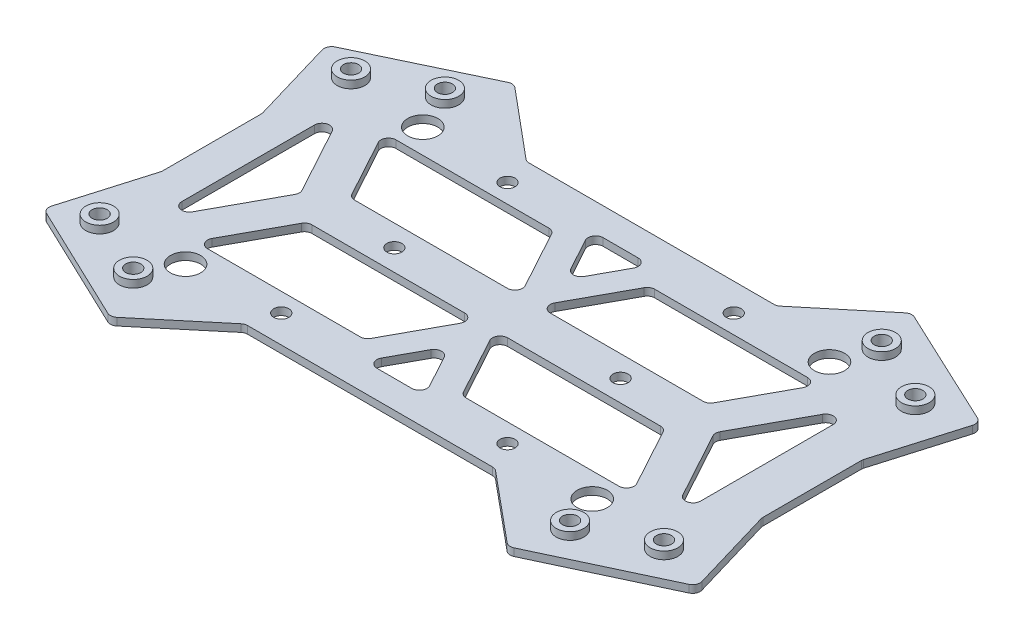
from build123d import *

# Parameters (mm, degrees)
SKETCH1_R               = 1.5
BOSS_EXTRUDE1_DEPTH     = 1.5
CUT_EXTRUDE3_DEPTH      = 78.112196707
CUT_EXTRUDE3_DEPTH_BACK = 1.5
SKETCH2_R               = 3
SKETCH2_R_2             = 1.5
FILLET1_R               = 1.5
FILLET2_R               = 1.5
FILLET3_R               = 1.5
FILLET4_R               = 1.5
SKETCH3_R               = 2.75
SKETCH3_R_2             = 1.5
BOSS_EXTRUDE2_DEPTH     = 1.5


with BuildPart() as part:
    # Sketch1 → Boss-Extrude1 (new body)
    with BuildSketch(Plane(origin=(0, 0, 0), x_dir=(1, 0, 0), z_dir=(0, 1, 0))):
        with BuildLine():
            Line((-39.718703085, 39.786008686), (-64.143839052, 28.145904827))
            Line((-64.143839052, 28.145904827), (-58.793839052, 10))
            Line((-58.793839052, 10), (-58.793839052, 0))
            Line((-58.793839052, 0), (60.6, 0))
            Line((60.6, 0), (60.6, 10))
            Line((60.6, 10), (65.947243643, 28.142062598))
            Line((65.947243643, 28.142062598), (41.112235129, 39.795412747))
            ThreePointArc((41.112235129, 39.795412747), (40.285063102, 39.92539514), (39.517091476, 39.591735783))
            Line((39.517091476, 39.591735783), (25.966587834, 28.345739563))
            ThreePointArc((25.966587834, 28.345739563), (25.517849862, 28.089079971), (25.008630192, 28))
            Line((25.008630192, 28), (-23.705783083, 28))
            ThreePointArc((-23.705783083, 28), (-24.217369993, 28.089936585), (-24.667609729, 28.348961555))
            Line((-24.667609729, 28.348961555), (-38.111565458, 39.582951958))
            ThreePointArc((-38.111565458, 39.582951958), (-38.885366706, 39.920082337), (-39.718703085, 39.786008686))
        make_face()
        with Locations(Location((-43.45, 31, 0), (0, 0, 270))):
            Circle(SKETCH1_R, mode=Mode.SUBTRACT)
        with Locations(Location((-56.13, 25, 0), (0, 0, 270))):
            Circle(SKETCH1_R, mode=Mode.SUBTRACT)
        with Locations(Location((56.13, 25, 0), (0, 0, 270))):
            Circle(SKETCH1_R, mode=Mode.SUBTRACT)
        with Locations(Location((43.45, 31, 0), (0, 0, 270))):
            Circle(SKETCH1_R, mode=Mode.SUBTRACT)
    extrude(amount=BOSS_EXTRUDE1_DEPTH)

    # Sketch2 → Cut-Extrude3 (cut, two sides: drawn at the far end of the back side and taken through both)
    with BuildSketch(Plane(origin=(0, 0, 0), x_dir=(1, 0, 0), z_dir=(0, 1, 0)).offset(-CUT_EXTRUDE3_DEPTH_BACK)):
        with Locations(Location((40.45, 23.6, 0), (0, 0, 270))):
            Circle(SKETCH2_R)
        with Locations(Location((-40.45, 23.6, 0), (0, 0, 270))):
            Circle(SKETCH2_R)
        with Locations(Location((-22.5, 22.5, 0), (0, 0, 270))):
            Circle(SKETCH2_R_2)
        with Locations(Location((22.5, 22.5, 0), (0, 0, 270))):
            Circle(SKETCH2_R_2)
        Polygon((-6, 22.5), (6, 22.5), (0, 11.5), align=None)
        Polygon((1.740892766, 4.25), (9.649983676, 18.75), (43.45, 18.75), (35.540909091, 4.25), align=None)
        Polygon((-43.45, 18.75), (-35.540909091, 4.25), (-1.740892766, 4.25), (-9.649983676, 18.75), align=None)
        Polygon((41.196340782, 0), (51.6, 19.073375233), (51.6, 0), align=None)
        Polygon((-51.6, 0), (-41.196340782, 0), (-51.6, 19.073375233), align=None)
        with BuildLine():
            Line((21, 0), (24, 0))
            ThreePointArc((24, 0), (22.5, 1.5), (21, 0))
        make_face()
        with BuildLine():
            Line((-24, 0), (-21, 0))
            ThreePointArc((-21, 0), (-22.5, 1.5), (-24, 0))
        make_face()
    extrude(amount=CUT_EXTRUDE3_DEPTH + CUT_EXTRUDE3_DEPTH_BACK, mode=Mode.SUBTRACT)

    # Mirror1: part across plane


with BuildPart() as part_1:
    add(part.part)
    add(part.part.mirror(Plane.XY))

    # Fillet1
    fillet1_edges = [part_1.edges().sort_by_distance(p)[0] for p in [
        (1.740892766, 0.75, -4.25),
        (35.540909091, 0.75, -4.25),
        (43.45, 0.75, -18.75),
        (9.649983676, 0.75, -18.75),
        (1.740892766, 0.75, 4.25),
        (35.540909091, 0.75, 4.25),
        (43.45, 0.75, 18.75),
        (9.649983676, 0.75, 18.75),
        (-9.649983676, 0.75, 18.75),
        (-43.45, 0.75, 18.75),
        (-35.540909091, 0.75, 4.25),
        (-1.740892766, 0.75, 4.25),
        (-9.649983676, 0.75, -18.75),
        (-43.45, 0.75, -18.75),
        (-35.540909091, 0.75, -4.25),
        (-1.740892766, 0.75, -4.25),
    ]]
    fillet(fillet1_edges, radius=FILLET1_R)

    # Fillet2
    fillet2_edges = [part_1.edges().sort_by_distance(p)[0] for p in [
        (51.6, 0.75, -19.073375233),
        (-51.6, 0.75, -19.073375233),
        (41.196340782, 0.75, 0),
        (-51.6, 0.75, 19.073375233),
        (-41.196340782, 0.75, 0),
        (51.6, 0.75, 19.073375233),
    ]]
    fillet(fillet2_edges, radius=FILLET2_R)

    # Fillet3
    fillet3_edges = [part_1.edges().sort_by_distance(p)[0] for p in [
        (-6, 0.75, -22.5),
        (0, 0.75, -11.5),
        (6, 0.75, -22.5),
        (-6, 0.75, 22.5),
        (0, 0.75, 11.5),
        (6, 0.75, 22.5),
    ]]
    fillet(fillet3_edges, radius=FILLET3_R)

    # Fillet4
    fillet4_edges = [part_1.edges().sort_by_distance(p)[0] for p in [
        (-58.793839052, 0.75, 10),
        (60.6, 0.75, 10),
        (65.947243643, 0.75, 28.142062598),
        (-64.143839052, 0.75, 28.145904827),
        (-64.143839052, 0.75, -28.145904827),
        (65.947243643, 0.75, -28.142062598),
        (60.6, 0.75, -10),
        (-58.793839052, 0.75, -10),
    ]]
    fillet(fillet4_edges, radius=FILLET4_R)

    # Sketch3 → Boss-Extrude2 (add)
    # profile 1 of 4: a face of its own
    with BuildSketch(Plane(origin=(0, 1.5, 0), x_dir=(1, 0, 0), z_dir=(0, 1, 0))):
        with Locations(Location((-56.13, 25, 0), (0, 0, 270))):
            Circle(SKETCH3_R)
        with Locations(Location((-56.13, 25, 0), (0, 0, 270))):
            Circle(SKETCH3_R_2, mode=Mode.SUBTRACT)
    # profile 2 of 4: a face of its own
    with BuildSketch(Plane(origin=(0, 1.5, 0), x_dir=(1, 0, 0), z_dir=(0, 1, 0))):
        with Locations(Location((-43.45, 31, 0), (0, 0, 270))):
            Circle(SKETCH3_R)
        with Locations(Location((-43.45, 31, 0), (0, 0, 270))):
            Circle(SKETCH3_R_2, mode=Mode.SUBTRACT)
    # profile 3 of 4: a face of its own
    with BuildSketch(Plane(origin=(0, 1.5, 0), x_dir=(1, 0, 0), z_dir=(0, 1, 0))):
        with Locations(Location((43.45, 31, 0), (0, 0, 270))):
            Circle(SKETCH3_R)
        with Locations(Location((43.45, 31, 0), (0, 0, 270))):
            Circle(SKETCH3_R_2, mode=Mode.SUBTRACT)
    # profile 4 of 4: a face of its own
    with BuildSketch(Plane(origin=(0, 1.5, 0), x_dir=(1, 0, 0), z_dir=(0, 1, 0))):
        with Locations(Location((56.13, 25, 0), (0, 0, 270))):
            Circle(SKETCH3_R)
        with Locations(Location((56.13, 25, 0), (0, 0, 270))):
            Circle(SKETCH3_R_2, mode=Mode.SUBTRACT)
    boss_extrude2 = extrude(amount=BOSS_EXTRUDE2_DEPTH)

    # Mirror2: Boss-Extrude2 across plane
    add(boss_extrude2.mirror(Plane.XY))


solid = part_1.part
